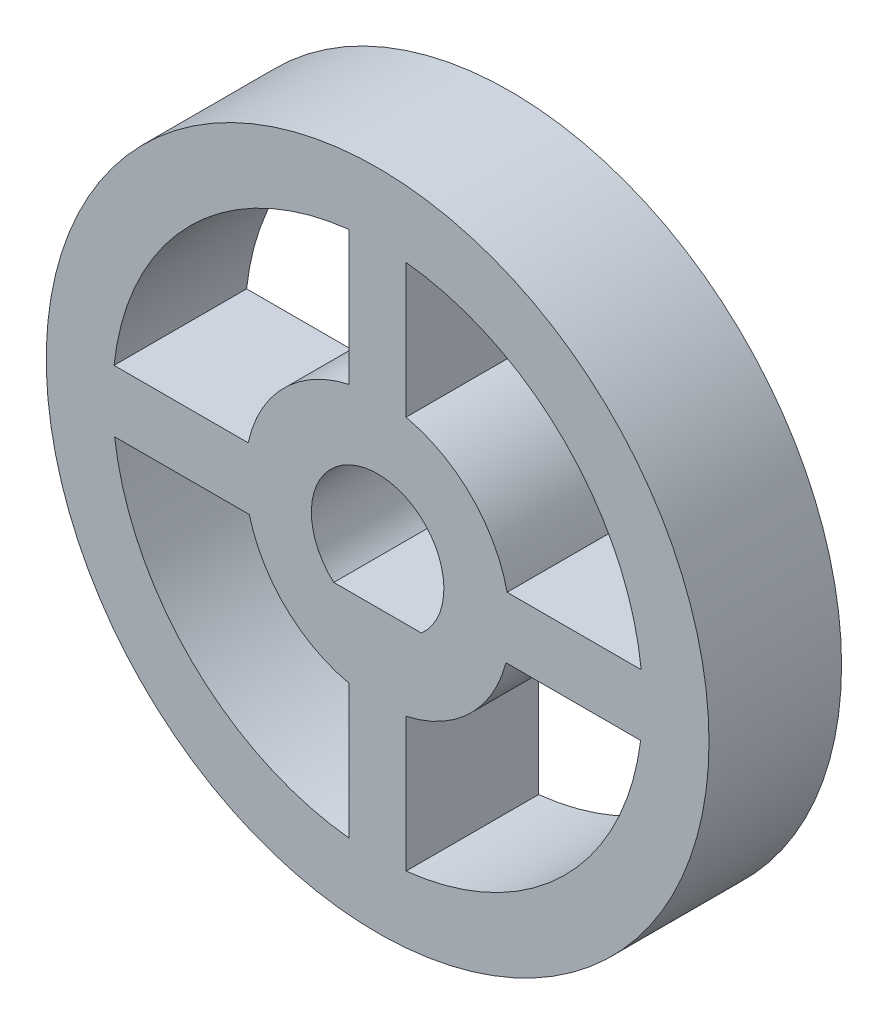
from build123d import *

# Parameters (mm, degrees)
SKETCH1_R           = 15
BOSS_EXTRUDE1_DEPTH = 6


with BuildPart() as part:
    # Sketch1 → Boss-Extrude1 (new body)
    with BuildSketch(Plane.XY):
        Circle(SKETCH1_R)
        with BuildLine():
            Line((-1.285714286, 5.860626142), (-1.285714286, 11.930923635))
            ThreePointArc((-1.285714286, 11.930923635), (-8.485281374, 8.485281374), (-11.930923635, 1.285714286))
            Line((-11.930923635, 1.285714286), (-5.860626142, 1.285714286))
            ThreePointArc((-5.860626142, 1.285714286), (-4.242640687, 4.242640687), (-1.285714286, 5.860626142))
        make_face(mode=Mode.SUBTRACT)
        with BuildLine():
            Line((1.285714286, 5.860626142), (1.285714286, 11.930923635))
            ThreePointArc((1.285714286, 11.930923635), (8.485281374, 8.485281374), (11.930923635, 1.285714286))
            Line((11.930923635, 1.285714286), (5.860626142, 1.285714286))
            ThreePointArc((5.860626142, 1.285714286), (4.242640687, 4.242640687), (1.285714286, 5.860626142))
        make_face(mode=Mode.SUBTRACT)
        with BuildLine():
            Line((-1.285714286, -11.930923635), (-1.285714286, -5.860626142))
            ThreePointArc((-1.285714286, -5.860626142), (-4.164035651, -4.319815632), (-5.809475019, -1.5))
            Line((-5.809475019, -1.5), (-11.9058809, -1.5))
            ThreePointArc((-11.9058809, -1.5), (-8.408661478, -8.561215577), (-1.285714286, -11.930923635))
        make_face(mode=Mode.SUBTRACT)
        with BuildLine():
            Line((1.285714286, -11.930923635), (1.285714286, -5.860626142))
            ThreePointArc((1.285714286, -5.860626142), (4.164035651, -4.319815632), (5.809475019, -1.5))
            Line((5.809475019, -1.5), (11.9058809, -1.5))
            ThreePointArc((11.9058809, -1.5), (8.408661478, -8.561215577), (1.285714286, -11.930923635))
        make_face(mode=Mode.SUBTRACT)
        with BuildLine():
            Line((-1.984313483, -2.25), (1.984313483, -2.25))
            ThreePointArc((1.984313483, -2.25), (0, 3), (-1.984313483, -2.25))
        make_face(mode=Mode.SUBTRACT)
    extrude(amount=BOSS_EXTRUDE1_DEPTH)


solid = part.part
